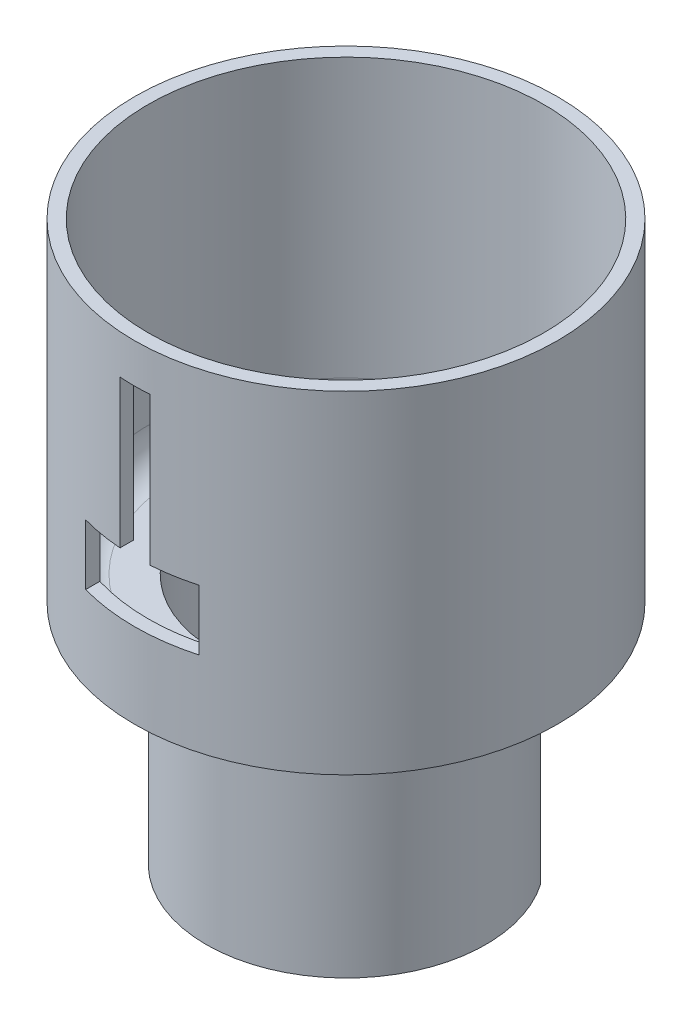
from build123d import *

# Parameters (mm, degrees)
SKETCH1_R                = 17.78
BOSS_EXTRUDE1_DEPTH      = 27.94
SKETCH2_R                = 11.7602
BOSS_EXTRUDE2_DEPTH      = 19.05
SKETCH3_R                = 16.637
CUT_EXTRUDE1_DEPTH       = 25.908
SKETCH4_R                = 11.049
CUT_EXTRUDE2_DEPTH       = 6.858
CUT_EXTRUDE3_DEPTH       = 38.588567411
CUT_EXTRUDE3_DEPTH_BACK  = 38.588567411
SKETCH5_W                = 5.0546
SKETCH5_H                = 12.7
BOSS_EXTRUDE3_DEPTH      = 0.9525
BOSS_EXTRUDE3_DEPTH_BACK = 0.9525
CUT_EXTRUDE4_DEPTH       = 12.192
FILLET1_R                = 2.54
CUT_EXTRUDE5_DEPTH       = 38.588567411
CUT_EXTRUDE6_REACH       = 55.295
SKETCH12_R               = 2.54


with BuildPart() as part:
    # Sketch1 → Boss-Extrude1 (new body)
    with BuildSketch(Plane(origin=(0, 0, 0), x_dir=(1, 0, 0), z_dir=(0, 1, 0))):
        with Locations(Location((0, 0, 0), (0, 0, 270))):
            Circle(SKETCH1_R)
    extrude(amount=BOSS_EXTRUDE1_DEPTH)

    # Sketch2 → Boss-Extrude2 (add)
    with BuildSketch(Plane(origin=(0, 0, 0), x_dir=(1, 0, 0), z_dir=(0, 1, 0))):
        with Locations(Location((0, 0, 0), (0, 0, 270))):
            Circle(SKETCH2_R)
    extrude(amount=-BOSS_EXTRUDE2_DEPTH)

    # Sketch3 → Cut-Extrude1 (cut)
    with BuildSketch(Plane(origin=(0, 27.94, 0), x_dir=(1, 0, 0), z_dir=(0, 1, 0))):
        with Locations(Location((0, 0, 0), (0, 0, 270))):
            Circle(SKETCH3_R)
    extrude(amount=-CUT_EXTRUDE1_DEPTH, mode=Mode.SUBTRACT)

    # Sketch4 → Cut-Extrude2 (cut)
    with BuildSketch(Plane(origin=(0, 2.032, 0), x_dir=(1, 0, 0), z_dir=(0, 1, 0))):
        with Locations(Location((0, 0, 0), (0, 0, 270))):
            Circle(SKETCH4_R)
    extrude(amount=-CUT_EXTRUDE2_DEPTH, mode=Mode.SUBTRACT)

    # Sketch5 → Cut-Extrude3 (cut, two sides: drawn at the far end of the back side and taken through both)
    with BuildSketch(Plane(origin=(0, 0, 0), x_dir=(0, 0, -1), z_dir=(1, 0, 0)).offset(-CUT_EXTRUDE3_DEPTH_BACK)):
        with Locations((9.2329, -12.7)):
            Rectangle(SKETCH5_W, SKETCH5_H)
    extrude(amount=CUT_EXTRUDE3_DEPTH + CUT_EXTRUDE3_DEPTH_BACK, mode=Mode.SUBTRACT)

    # Sketch7 → Boss-Extrude3 (add, two sides: drawn at the far end of the back side and taken through both)
    with BuildSketch(Plane(origin=(0, 0, 0), x_dir=(0, 0, -1), z_dir=(1, 0, 0)).offset(-BOSS_EXTRUDE3_DEPTH_BACK)):
        Polygon((11.7602, -6.35), (11.7602, -14.788545455), (6.7056, -19.05), (6.7056, -16.392200431), (9.7282, -13.843893442), (9.7282, -6.35), align=None)
    extrude(amount=BOSS_EXTRUDE3_DEPTH + BOSS_EXTRUDE3_DEPTH_BACK)

    # Sketch9 → Cut-Extrude4 (cut)
    with BuildSketch(Plane(origin=(0, -4.826, 0), x_dir=(1, 0, 0), z_dir=(0, 1, 0))):
        with BuildLine():
            Line((9.619493419, 5.4356), (-9.619493419, 5.4356))
            ThreePointArc((-9.619493419, 5.4356), (-2.810215135, -10.685648876), (11.049, 0))
            ThreePointArc((11.049, 0), (10.685648876, 2.810215135), (9.619493419, 5.4356))
        make_face()
    extrude(amount=-CUT_EXTRUDE4_DEPTH, mode=Mode.SUBTRACT)

    # Fillet1
    fillet1_edges = [part.edges().sort_by_distance(p)[0] for p in [
        (0, 2.032, -16.637),
    ]]
    fillet(fillet1_edges, radius=FILLET1_R)

    # Sketch11 → Cut-Extrude5 (cut, through all)
    with BuildSketch(Plane.XY):
        Polygon((-2.532708507, 7.112), (-4.7625, 7.112), (-4.7625, 12.192), (-1.27, 12.192), (-1.27, 24.638), (1.27, 24.638), (1.27, 12.192), (4.7625, 12.192), (4.7625, 7.112), (2.532708507, 7.112), align=None)
    extrude(amount=CUT_EXTRUDE5_DEPTH, mode=Mode.SUBTRACT)

    # Sketch12 → Cut-Extrude6 (cut, up to next)
    with BuildSketch(Plane.XZ.offset(19.05), mode=Mode.PRIVATE) as cut_extrude6_sk1:
        with Locations(Location((0, 0, 0), (0, 0, 270))):
            Circle(SKETCH12_R)
    cut_extrude6_tool1 = extrude(cut_extrude6_sk1.sketch, amount=-CUT_EXTRUDE6_REACH, mode=Mode.PRIVATE) & part.part
    add(cut_extrude6_tool1.solids().sort_by_distance((0, -19.05, 0))[0], mode=Mode.SUBTRACT)


solid = part.part
